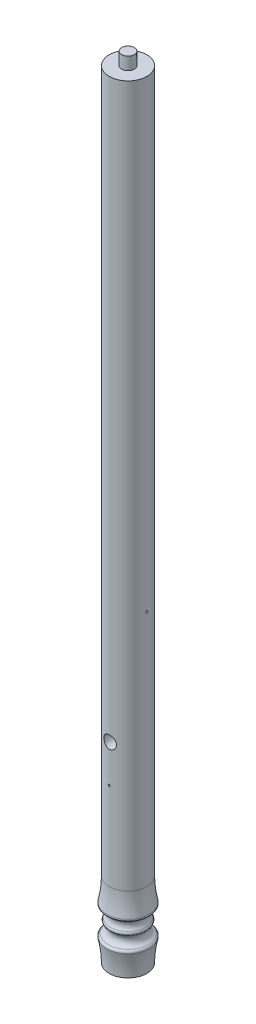
from build123d import *

# Parameters (mm, degrees)
CUT_EXTRUDE2_START = -12.7
SKETCH16_R         = 0.9921875
CUT_EXTRUDE2_DEPTH = 12.7
CUT_EXTRUDE3_START = -19.05
SKETCH17_R         = 6.35
CUT_EXTRUDE3_DEPTH = 19.05
CUT_EXTRUDE4_START = -12.7
SKETCH18_R         = 0.9921875
CUT_EXTRUDE4_DEPTH = 12.7


with BuildPart() as part:
    # revolve sketch → Revolve1 (revolve)
    with BuildSketch(Plane.XY, mode=Mode.PRIVATE) as revolve1_sk:
        with BuildLine():
            Line((0, 0), (19.05, 0))
            ThreePointArc((19.05, 0), (19.692539758, 11.497446902), (21.612156952, 22.851706562))
            ThreePointArc((21.612156952, 22.851706562), (21.368821871, 24.623609523), (20.018018165, 25.795864363))
            ThreePointArc((20.018018165, 25.795864363), (17.012666806, 28.123144244), (15.875, 31.75))
            ThreePointArc((15.875, 31.75), (16.370840305, 34.209941923), (17.780925752, 36.285714286))
            ThreePointArc((17.780925752, 36.285714286), (18.543296053, 38.1), (17.780925752, 39.914285714))
            ThreePointArc((17.780925752, 39.914285714), (16.370840305, 41.990058077), (15.875, 44.45))
            ThreePointArc((15.875, 44.45), (17.012666806, 48.076855756), (20.018018165, 50.404135637))
            ThreePointArc((20.018018165, 50.404135637), (21.368821871, 51.576390477), (21.612156952, 53.348293438))
            ThreePointArc((21.612156952, 53.348293438), (19.692539758, 64.702553098), (19.05, 76.2))
            Line((19.05, 76.2), (19.05, 787.4))
            Line((19.05, 787.4), (6.35, 787.4))
            Line((6.35, 787.4), (6.35, 800.1))
            Line((6.35, 800.1), (0, 800.1))
            Line((0, 800.1), (0, 0))
        make_face()
    revolve(revolve1_sk.sketch.rotate(Axis((0, -55, 0), (0, 1, 0)), 90), axis=Axis((0, -55, 0), (0, 1, 0)))

    # Sketch16 → Cut-Extrude2 (cut)
    with BuildSketch(Plane(origin=(19.05, 0, 0), x_dir=(0, 0, -1), z_dir=(1, 0, 0)).offset(CUT_EXTRUDE2_START)):
        with Locations((0, 317.5)):
            Circle(SKETCH16_R)
    extrude(amount=CUT_EXTRUDE2_DEPTH, mode=Mode.SUBTRACT)

    # Sketch17 → Cut-Extrude3 (cut)
    with BuildSketch(Plane.XY.offset(19.05).offset(CUT_EXTRUDE3_START)):
        with Locations((0, 203.2)):
            Circle(SKETCH17_R)
    extrude(amount=CUT_EXTRUDE3_DEPTH, mode=Mode.SUBTRACT)

    # Sketch18 → Cut-Extrude4 (cut)
    with BuildSketch(Plane.XY.offset(19.05).offset(CUT_EXTRUDE4_START)):
        with Locations((0, 165.1)):
            Circle(SKETCH18_R)
    extrude(amount=CUT_EXTRUDE4_DEPTH, mode=Mode.SUBTRACT)


solid = part.part
